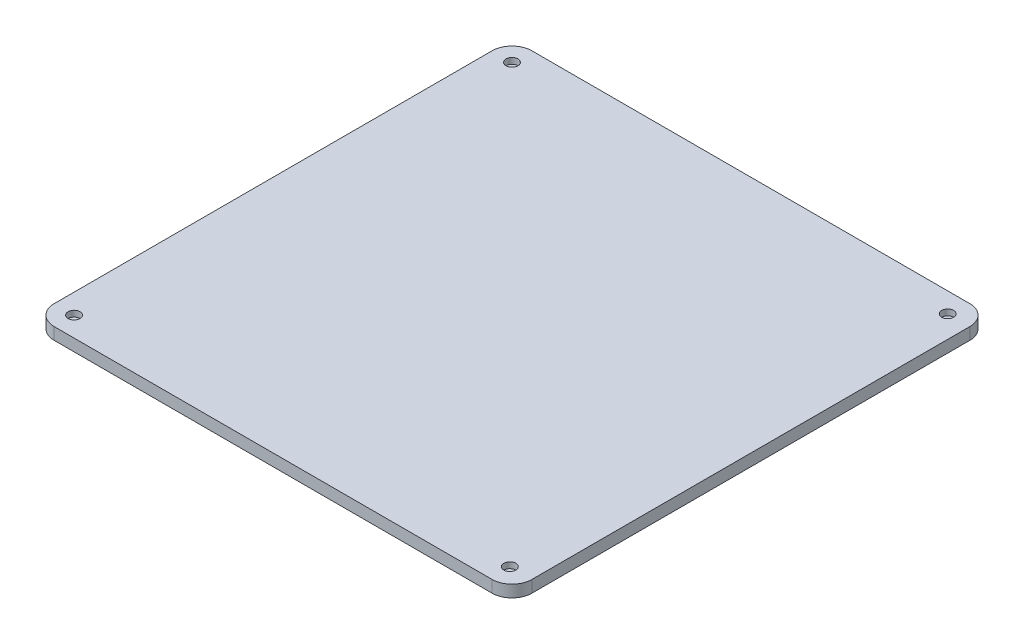
from build123d import *

# Parameters (mm, degrees)
SKETCH1_W           = 120
SKETCH1_H           = 120
BOSS_EXTRUDE1_DEPTH = 3
FILLET1_R           = 5
SKETCH2_R           = 1.5
CUT_EXTRUDE1_DEPTH  = 1.5


with BuildPart() as part:
    # Sketch1 → Boss-Extrude1 (new body)
    with BuildSketch(Plane(origin=(0, 0, 0), x_dir=(1, 0, 0), z_dir=(0, 1, 0))):
        Rectangle(SKETCH1_W, SKETCH1_H)
    extrude(amount=BOSS_EXTRUDE1_DEPTH)

    # Fillet1
    fillet1_edges = [part.edges().sort_by_distance(p)[0] for p in [
        (60, 1.5, 60),
        (-60, 1.5, 60),
        (-60, 1.5, -60),
        (60, 1.5, -60),
    ]]
    fillet(fillet1_edges, radius=FILLET1_R)

    # Sketch2 → Cut-Extrude1 (cut)
    with BuildSketch(Plane(origin=(0, 3, 0), x_dir=(1, 0, 0), z_dir=(0, 1, 0))):
        with Locations(Location((-55, 55, 0), (0, 0, 270))):
            Circle(SKETCH2_R)
        with Locations(Location((54.451089289, 55, 0), (0, 0, 270))):
            Circle(SKETCH2_R)
        with Locations(Location((-55, -55, 0), (0, 0, 270))):
            Circle(SKETCH2_R)
        with Locations(Location((54.451089289, -55, 0), (0, 0, 270))):
            Circle(SKETCH2_R)
    extrude(amount=-CUT_EXTRUDE1_DEPTH, mode=Mode.SUBTRACT)


solid = part.part
